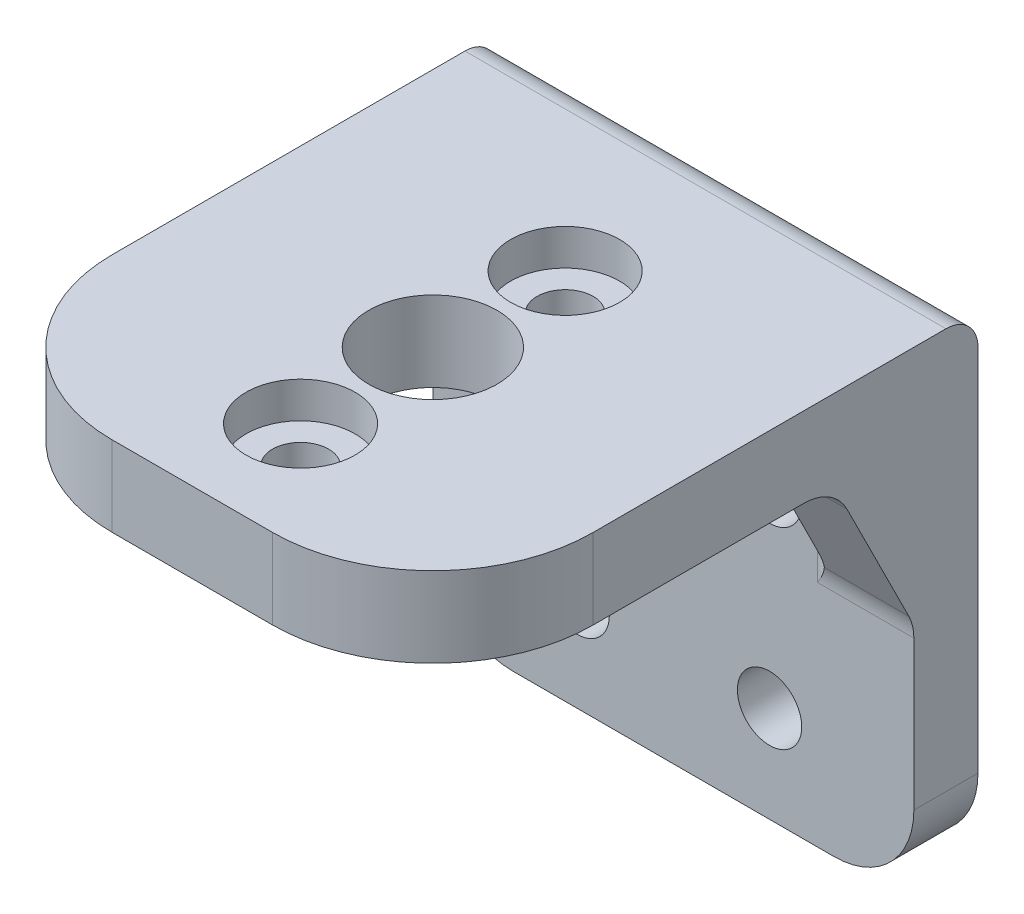
from build123d import *

# Parameters (mm, degrees)
CROQUIS1_R              = 2.005138112
SALIENTE_EXTRUIR1_DEPTH = 4
CROQUIS2_W              = 30
CROQUIS2_H              = 5
SALIENTE_EXTRUIR2_DEPTH = 30
CROQUIS3_R              = 1.75
CROQUIS3_R_2            = 4
CORTAR_EXTRUIR1_DEPTH   = 52.778373864
REDONDEO1_R             = 10
REDONDEO2_R             = 5
REDONDEO4_R             = 2
CROQUIS4_R              = 3.4
CORTAR_EXTRUIR2_DEPTH   = 2.25
NERVIO12_REACH          = 56.369
CROQUIS7_WALL_W         = 121.91855764
CROQUIS7_WALL_H         = 5
NERVIO13_REACH          = 56.369
CROQUIS8_WALL_W         = 121.91855764
CROQUIS8_WALL_H         = 5
REDONDEO6_R             = 3
REDONDEO7_R             = 2
REDONDEO8_R             = 1


with BuildPart() as part:
    # Croquis1 → Saliente-Extruir1 (new body)
    with BuildSketch(Plane.XY):
        Polygon((0, 21.15), (0, 30), (30, 30), (30, 21.15), (30, 14.85), (30, 0), (0, 0), (0, 14.85), align=None)
        with Locations((9, 18)):
            Circle(CROQUIS1_R, mode=Mode.SUBTRACT)
        with Locations((21, 18)):
            Circle(CROQUIS1_R, mode=Mode.SUBTRACT)
        with Locations((21, 6)):
            Circle(CROQUIS1_R, mode=Mode.SUBTRACT)
        with Locations((9, 6)):
            Circle(CROQUIS1_R, mode=Mode.SUBTRACT)
    extrude(amount=SALIENTE_EXTRUIR1_DEPTH)

    # Croquis2 → Saliente-Extruir2 (add)
    with BuildSketch(Plane.XY.offset(4)):
        with Locations((15, 27.5)):
            Rectangle(CROQUIS2_W, CROQUIS2_H)
    extrude(amount=SALIENTE_EXTRUIR2_DEPTH)

    # Croquis3 → Cortar-Extruir1 (cut, through all)
    with BuildSketch(Plane.XZ.offset(-25)):
        with Locations(Location((15, 27.25, 0), (0, 0, 270))):
            Circle(CROQUIS3_R)
        with Locations(Location((15, 10.75, 0), (0, 0, 270))):
            Circle(CROQUIS3_R)
        with Locations(Location((15, 19, 0), (0, 0, 270))):
            Circle(CROQUIS3_R_2)
    extrude(amount=-CORTAR_EXTRUIR1_DEPTH, mode=Mode.SUBTRACT)

    # Redondeo1
    redondeo1_edges = [part.edges().sort_by_distance(p)[0] for p in [
        (0, 27.5, 34),
        (30, 27.5, 34),
    ]]
    fillet(redondeo1_edges, radius=REDONDEO1_R)

    # Redondeo2
    redondeo2_edges = [part.edges().sort_by_distance(p)[0] for p in [
        (30, 0, 2),
        (0, 0, 2),
    ]]
    fillet(redondeo2_edges, radius=REDONDEO2_R)

    # Redondeo4
    redondeo4_edges = [part.edges().sort_by_distance(p)[0] for p in [
        (15, 30, 0),
    ]]
    fillet(redondeo4_edges, radius=REDONDEO4_R)

    # Croquis4 → Cortar-Extruir2 (cut)
    with BuildSketch(Plane(origin=(0, 30, 0), x_dir=(1, 0, 0), z_dir=(0, 1, 0))):
        with Locations(Location((15, -10.75, 0), (0, 0, 270))):
            Circle(CROQUIS4_R)
        with Locations(Location((15, -27.25, 0), (0, 0, 270))):
            Circle(CROQUIS4_R)
    extrude(amount=-CORTAR_EXTRUIR2_DEPTH, mode=Mode.SUBTRACT)

    # Croquis7 wall → Nervio12 (add, up to next)
    with BuildSketch(Plane(origin=(30, 20, 6.5), x_dir=(0, -0.894427191, -0.4472135955), z_dir=(0, 0.4472135955, -0.894427191)), mode=Mode.PRIVATE) as nervio12_sk1:
        with Locations((0, 2.5)):
            Rectangle(CROQUIS7_WALL_W, CROQUIS7_WALL_H)
    nervio12_tool1 = extrude(nervio12_sk1.sketch, amount=NERVIO12_REACH, mode=Mode.PRIVATE) - part.part
    add(nervio12_tool1.solids().sort_by_distance((30, 20, 6.5))[0])

    # Croquis8 wall → Nervio13 (add, up to next)
    with BuildSketch(Plane(origin=(0, 20, 6.5), x_dir=(0, 0.894427191, 0.4472135955), z_dir=(0, 0.4472135955, -0.894427191)), mode=Mode.PRIVATE) as nervio13_sk1:
        with Locations((0, 2.5)):
            Rectangle(CROQUIS8_WALL_W, CROQUIS8_WALL_H)
    nervio13_tool1 = extrude(nervio13_sk1.sketch, amount=NERVIO13_REACH, mode=Mode.PRIVATE) - part.part
    add(nervio13_tool1.solids().sort_by_distance((0, 20, 6.5))[0])

    # Redondeo6
    redondeo6_edges = [part.edges().sort_by_distance(p)[0] for p in [
        (27.5, 25, 9),
        (27.5, 15, 4),
        (2.5, 25, 9),
        (2.5, 15, 4),
    ]]
    fillet(redondeo6_edges, radius=REDONDEO6_R)

    # Redondeo7
    redondeo7_edges = [part.edges().sort_by_distance(p)[0] for p in [
        (15, 25, 4),
    ]]
    fillet(redondeo7_edges, radius=REDONDEO7_R)

    # Redondeo8
    redondeo8_edges = [part.edges().sort_by_distance(p)[0] for p in [
        (5, 25, 8.427050983),
        (5, 24.414213562, 4.585786438),
        (5, 18.645898034, 4),
        (25, 25, 8.427050983),
        (25, 24.414213562, 4.585786438),
        (25, 18.645898034, 4),
    ]]
    fillet(redondeo8_edges, radius=REDONDEO8_R)


solid = part.part
